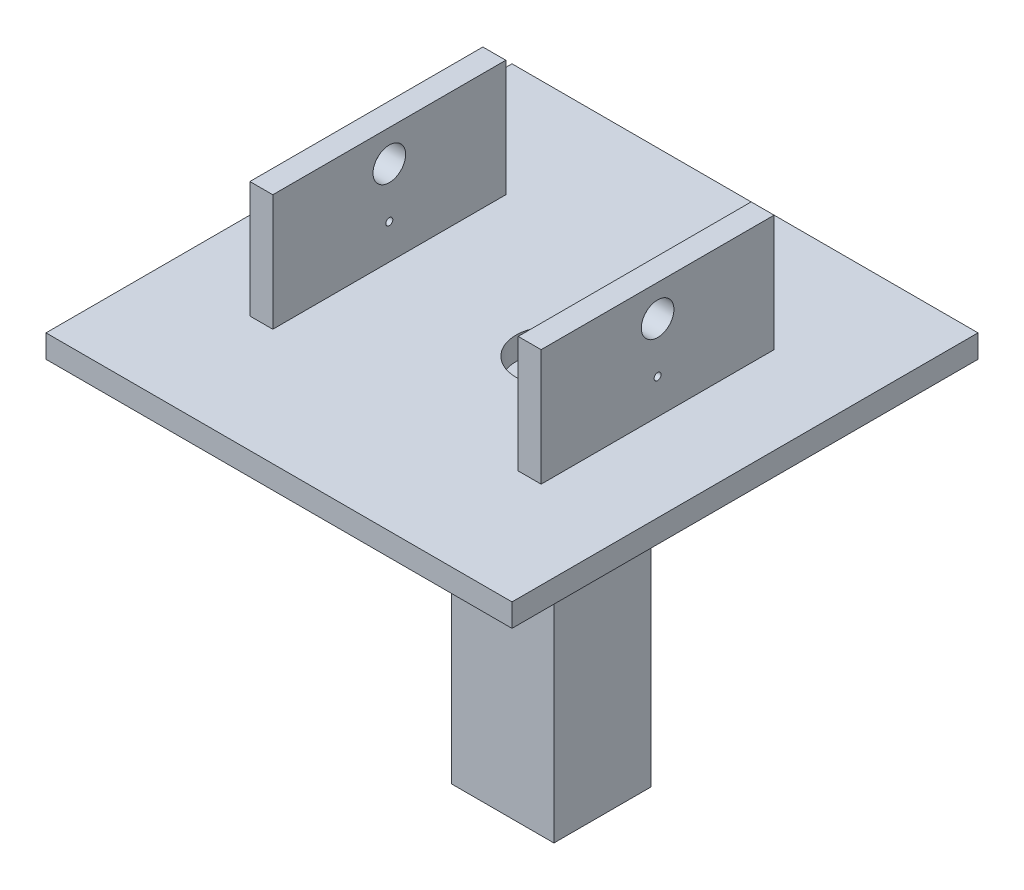
from build123d import *

# Parameters (mm, degrees)
SKETCH2_W           = 101.6
SKETCH2_H           = 101.6
BOSS_EXTRUDE2_DEPTH = 5
SKETCH3_W           = 5
SKETCH3_H           = 50.8
BOSS_EXTRUDE3_DEPTH = 25.4
SKETCH4_W           = 5
SKETCH4_H           = 50.8
BOSS_EXTRUDE4_DEPTH = 25.4
SKETCH8_R           = 3.556
CUT_EXTRUDE1_DEPTH  = 135.392047756
CUT_EXTRUDE2_REACH  = 136.392
SKETCH9_R           = 0.762
SKETCH11_R          = 7.9502
CUT_EXTRUDE3_DEPTH  = 146.911891222
CUT_EXTRUDE5_REACH  = 136.392
SKETCH18_R          = 0.762
SKETCH19_W          = 22.350467385
SKETCH19_H          = 21.198381437
BOSS_EXTRUDE5_DEPTH = 76.2
SKETCH22_R          = 5
CUT_EXTRUDE6_DEPTH  = 179.909697893


with BuildPart() as part:
    # Sketch2 → Boss-Extrude2 (new body)
    with BuildSketch(Plane(origin=(0, 0, 0), x_dir=(1, 0, 0), z_dir=(0, 1, 0))):
        with Locations((50.8, -50.8)):
            Rectangle(SKETCH2_W, SKETCH2_H)
    extrude(amount=BOSS_EXTRUDE2_DEPTH)

    # Sketch3 → Boss-Extrude3 (add)
    with BuildSketch(Plane(origin=(0, 5, 0), x_dir=(1, 0, 0), z_dir=(0, 1, 0))):
        with Locations((21.55, -50.8)):
            Rectangle(SKETCH3_W, SKETCH3_H)
    extrude(amount=BOSS_EXTRUDE3_DEPTH)

    # Sketch4 → Boss-Extrude4 (add)
    with BuildSketch(Plane(origin=(0, 5, 0), x_dir=(1, 0, 0), z_dir=(0, 1, 0))):
        with Locations((80.05, -50.8)):
            Rectangle(SKETCH4_W, SKETCH4_H)
    extrude(amount=BOSS_EXTRUDE4_DEPTH)

    # Sketch8 → Cut-Extrude1 (cut, through all)
    with BuildSketch(Plane.ZY.offset(-19.05)):
        with Locations((50.8, 23.542)):
            Circle(SKETCH8_R)
    extrude(amount=-CUT_EXTRUDE1_DEPTH, mode=Mode.SUBTRACT)

    # Sketch9 → Cut-Extrude2 (cut, up to next)
    with BuildSketch(Plane(origin=(82.55, 0, 0), x_dir=(0, 0, -1), z_dir=(1, 0, 0)), mode=Mode.PRIVATE) as cut_extrude2_sk1:
        with Locations((-50.8, 12.62)):
            Circle(SKETCH9_R)
    cut_extrude2_tool1 = extrude(cut_extrude2_sk1.sketch, amount=-CUT_EXTRUDE2_REACH, mode=Mode.PRIVATE) & part.part
    add(cut_extrude2_tool1.solids().sort_by_distance((82.55, 12.62, 50.8))[0], mode=Mode.SUBTRACT)

    # Sketch11 → Cut-Extrude3 (cut, through all)
    with BuildSketch(Plane(origin=(0, 5, 0), x_dir=(1, 0, 0), z_dir=(0, 1, 0))):
        with Locations(Location((59.61, -50.8, 0), (0, 0, 270))):
            Circle(SKETCH11_R)
    extrude(amount=-CUT_EXTRUDE3_DEPTH, mode=Mode.SUBTRACT)

    # Sketch18 → Cut-Extrude5 (cut, up to next)
    with BuildSketch(Plane.ZY.offset(-19.05), mode=Mode.PRIVATE) as cut_extrude5_sk1:
        with Locations(Location((50.8, 12.62, 0), (0, 0, 180))):
            Circle(SKETCH18_R)
    cut_extrude5_tool1 = extrude(cut_extrude5_sk1.sketch, amount=-CUT_EXTRUDE5_REACH, mode=Mode.PRIVATE) & part.part
    add(cut_extrude5_tool1.solids().sort_by_distance((19.05, 12.62, 50.8))[0], mode=Mode.SUBTRACT)

    # Sketch19 → Boss-Extrude5 (add)
    with BuildSketch(Plane.XZ):
        with Locations((59.324658632, 50.761526183)):
            Rectangle(SKETCH19_W, SKETCH19_H)
    extrude(amount=BOSS_EXTRUDE5_DEPTH)

    # Sketch22 → Cut-Extrude6 (cut, through all)
    with BuildSketch(Plane.XZ.offset(76.2)):
        with Locations(Location((59.61, 50.8, 0), (0, 0, 270))):
            Circle(SKETCH22_R)
    extrude(amount=-CUT_EXTRUDE6_DEPTH, mode=Mode.SUBTRACT)


solid = part.part
